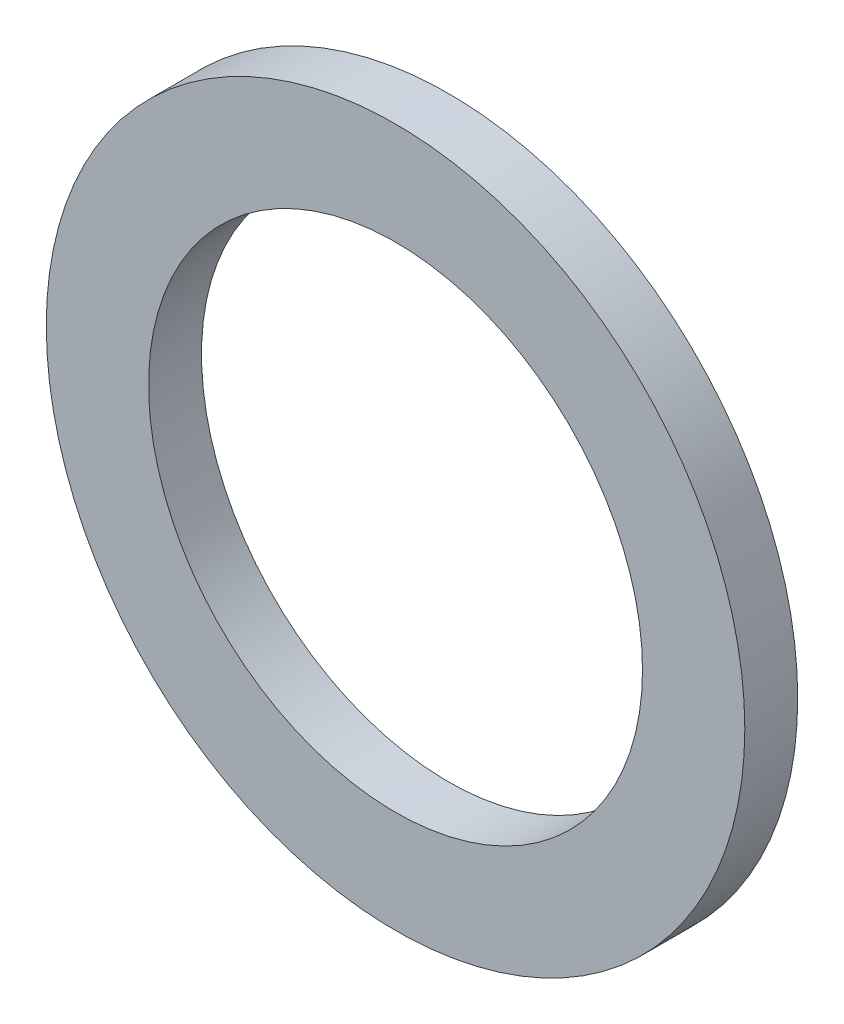
from build123d import *

# Parameters (mm, degrees)
ESQUISSE1_R          = 9.9
ESQUISSE1_R_2        = 7
BASE_EXTRUSION_DEPTH = 1.5


with BuildPart() as part:
    # Esquisse1 → Base-Extrusion (new body)
    with BuildSketch(Plane.XY):
        Circle(ESQUISSE1_R)
        Circle(ESQUISSE1_R_2, mode=Mode.SUBTRACT)
    extrude(amount=BASE_EXTRUSION_DEPTH)


solid = part.part
